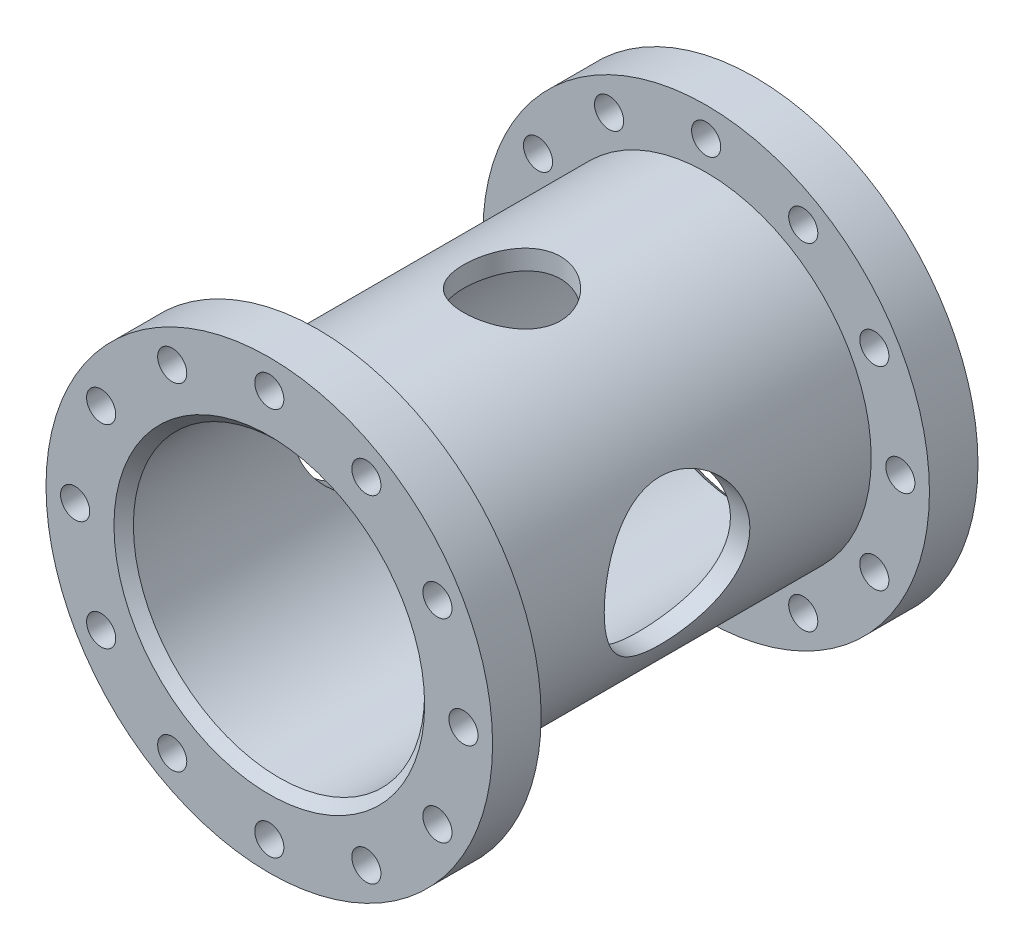
from build123d import *

# Parameters (mm, degrees)
SKETCH1_R                  = 85
SKETCH1_R_2                = 75
BOSS_EXTRUDE1_DEPTH        = 100
SKETCH2_R                  = 115
SKETCH2_R_2                = 75
BOSS_EXTRUDE2_DEPTH        = 25
F_15_0_15_DIAMETER_HOLE1_D = 15
CIRPATTERN1_COUNT          = 12
CHAMFER1_SIZE              = 5
CUT_EXTRUDE1_DEPTH         = 206.121914968
CUT_EXTRUDE1_DEPTH_BACK    = 206.121914968
SKETCH5_R                  = 37.5
CUT_EXTRUDE2_DEPTH         = 206.121914968
CUT_EXTRUDE2_DEPTH_BACK    = 206.121914968
SKETCH7_R                  = 25


with BuildPart() as part:
    # Sketch1 → Boss-Extrude1 (new body)
    with BuildSketch(Plane.XY):
        Circle(SKETCH1_R)
        Circle(SKETCH1_R_2, mode=Mode.SUBTRACT)
    extrude(amount=BOSS_EXTRUDE1_DEPTH)

    # Sketch2 → Boss-Extrude2 (add)
    with BuildSketch(Plane.XY.offset(100)):
        Circle(SKETCH2_R)
        Circle(SKETCH2_R_2, mode=Mode.SUBTRACT)
    extrude(amount=BOSS_EXTRUDE2_DEPTH)

    # Ø15.0 (15) Diameter Hole1 (through all)
    with Locations(Plane.XY.offset(125)):
        with Locations((0, 100)):
            f_15_0_15_diameter_hole1 = Hole(F_15_0_15_DIAMETER_HOLE1_D / 2)

    # CirPattern1: Ø15.0 (15) Diameter Hole1 ×12 about axis
    cirpattern1_axis = Axis((0, 0, 0), (0, 0, 1))
    for i in range(1, CIRPATTERN1_COUNT):
        add(f_15_0_15_diameter_hole1.rotate(cirpattern1_axis, i * 360 / CIRPATTERN1_COUNT), mode=Mode.SUBTRACT)

    # Chamfer1
    chamfer1_edges = [part.edges().sort_by_distance(p)[0] for p in [
        (-75, 0, 125),
    ]]
    chamfer(chamfer1_edges, length=CHAMFER1_SIZE)

    # Mirror1: part across plane


with BuildPart() as part_1:
    add(part.part)
    add(part.part.mirror(Plane.XY))

    # Sketch5 → Cut-Extrude1 (cut, two sides: drawn at the far end of the back side and taken through both)
    with BuildSketch(Plane(origin=(0, 0, 0), x_dir=(0, 0, -1), z_dir=(1, 0, 0)).offset(-CUT_EXTRUDE1_DEPTH_BACK)):
        Circle(SKETCH5_R)
    extrude(amount=CUT_EXTRUDE1_DEPTH + CUT_EXTRUDE1_DEPTH_BACK, mode=Mode.SUBTRACT)

    # Sketch7 → Cut-Extrude2 (cut, two sides: drawn at the far end of the back side and taken through both)
    with BuildSketch(Plane(origin=(0, 0, 0), x_dir=(1, 0, 0), z_dir=(0, 1, 0)).offset(-CUT_EXTRUDE2_DEPTH_BACK)):
        with Locations(Location((0, 0, 0), (0, 0, 270))):
            Circle(SKETCH7_R)
    extrude(amount=CUT_EXTRUDE2_DEPTH + CUT_EXTRUDE2_DEPTH_BACK, mode=Mode.SUBTRACT)


solid = part_1.part
